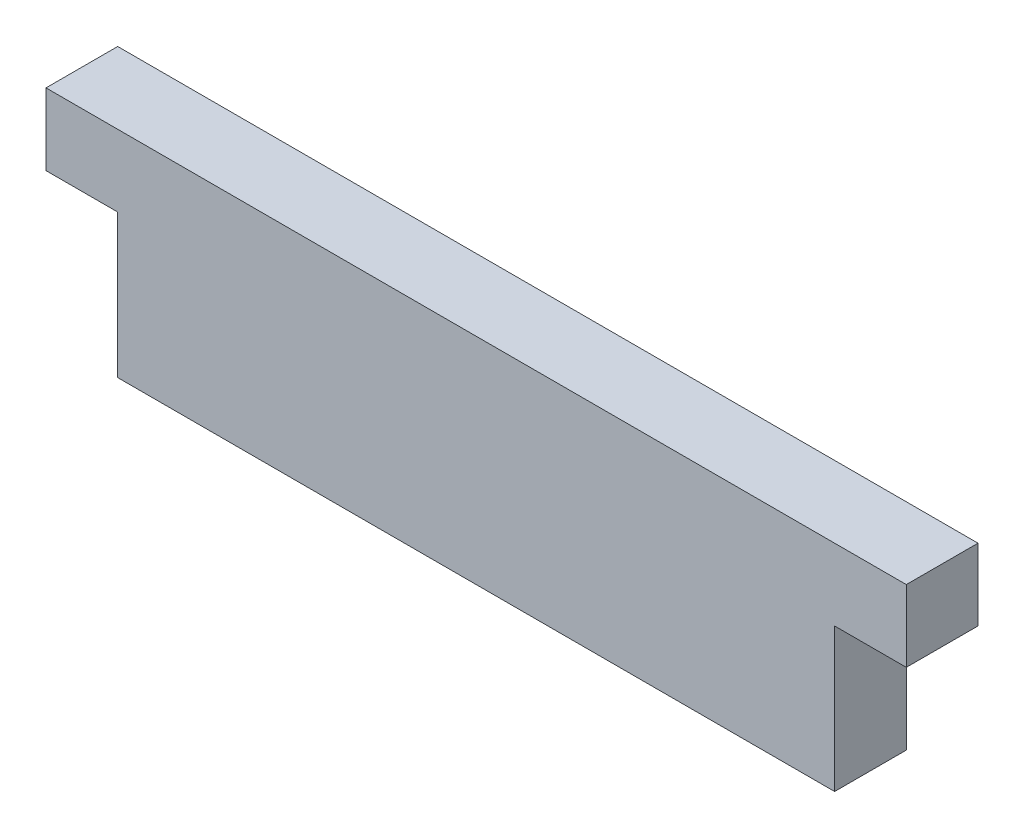
from build123d import *

# Parameters (mm, degrees)
SKETCH1_W           = 50
SKETCH1_H           = 10
BOSS_EXTRUDE1_DEPTH = 5


with BuildPart() as part:
    # Sketch1 → Boss-Extrude1 (new body)
    with BuildSketch(Plane.XY):
        with Locations((-25, -5)):
            Rectangle(SKETCH1_W, SKETCH1_H)
        Polygon((-50, 0), (0, 0), (5, 0), (5, 5), (-55, 5), (-55, 0), align=None)
    extrude(amount=BOSS_EXTRUDE1_DEPTH)


solid = part.part
